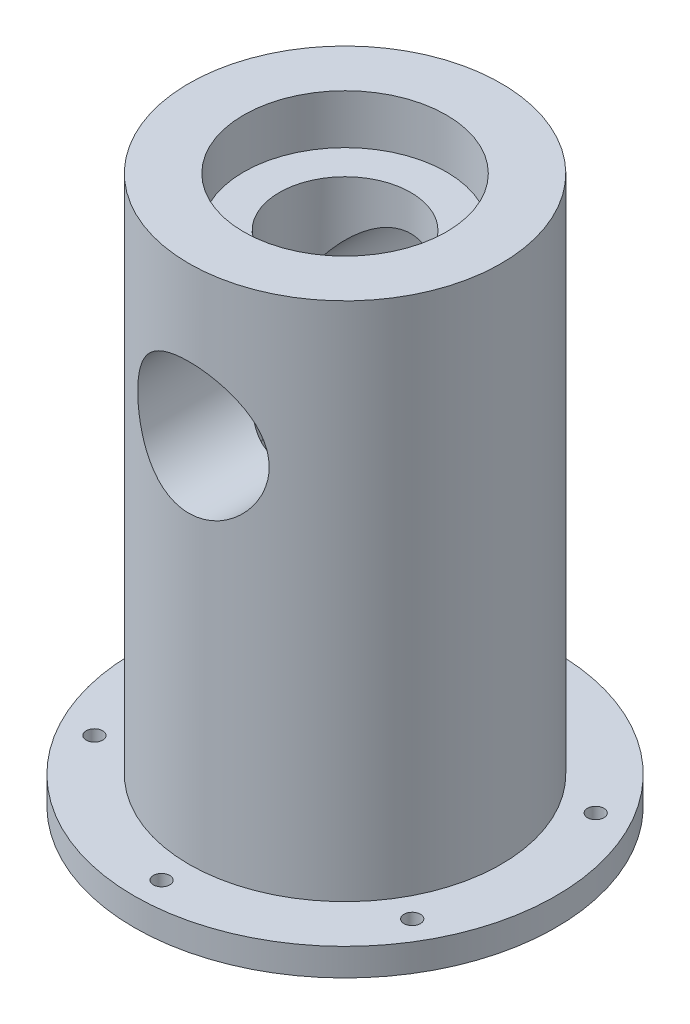
from build123d import *

# Parameters (mm, degrees)
ESQUISSE1_R             = 38.5
BOSS_EXTRU_1_DEPTH      = 100
ENL_V_START             = -95
ESQUISSE2_R             = 38.5
ESQUISSE2_R_2           = 28.5
ENL_V_MAT_EXTRU_1_DEPTH = 95
ESQUISSE4_R             = 22.5
ENL_V_MAT_EXTRU_2_DEPTH = 45
ESQUISSE5_R             = 18.5
ENL_V_MAT_EXTRU_3_DEPTH = 9
ESQUISSE6_R             = 12
ENL_V_MAT_EXTRU_4_DEPTH = 77.684418235
D_GAGEMENT_M222_D       = 24
ESQUISSE14_R            = 1.5
ENL_V_MAT_EXTRU_8_DEPTH = 77.684418235
ENL_V_START_2           = -9
ESQUISSE16_R            = 18.5
ENL_V_MAT_EXTRU_9_DEPTH = 9


with BuildPart() as part:
    # Esquisse1 → Boss.-Extru.1 (new body)
    with BuildSketch(Plane(origin=(0, 0, 0), x_dir=(1, 0, 0), z_dir=(0, 1, 0))):
        with Locations(Location((0, 0, 0), (0, 0, 270))):
            Circle(ESQUISSE1_R)
    extrude(amount=BOSS_EXTRU_1_DEPTH)

    # Esquisse2 → Enlèv. mat.-Extru.1 (cut)
    with BuildSketch(Plane(origin=(0, 100, 0), x_dir=(1, 0, 0), z_dir=(0, 1, 0)).offset(ENL_V_START)):
        with Locations(Location((0, 0, 0), (0, 0, 270))):
            Circle(ESQUISSE2_R)
        with Locations(Location((0, 0, 0), (0, 0, 270))):
            Circle(ESQUISSE2_R_2, mode=Mode.SUBTRACT)
    extrude(amount=ENL_V_MAT_EXTRU_1_DEPTH, mode=Mode.SUBTRACT)

    # Esquisse4 → Enlèv. mat.-Extru.2 (cut)
    with BuildSketch(Plane(origin=(0, 0, 0), x_dir=(-1, 0, 0), z_dir=(0, -1, 0))):
        with Locations(Location((0, 0, 0), (0, 0, 90))):
            Circle(ESQUISSE4_R)
    extrude(amount=-ENL_V_MAT_EXTRU_2_DEPTH, mode=Mode.SUBTRACT)

    # Esquisse5 → Enlèv. mat.-Extru.3 (cut)
    with BuildSketch(Plane(origin=(0, 45, 0), x_dir=(-1, 0, 0), z_dir=(0, -1, 0))):
        with Locations(Location((0, 0, 0), (0, 0, 90))):
            Circle(ESQUISSE5_R)
    extrude(amount=-ENL_V_MAT_EXTRU_3_DEPTH, mode=Mode.SUBTRACT)

    # Esquisse6 → Enlèv. mat.-Extru.4 (cut, through all)
    with BuildSketch(Plane(origin=(0, 54, 0), x_dir=(-1, 0, 0), z_dir=(0, -1, 0))):
        with Locations(Location((0, 0, 0), (0, 0, 90))):
            Circle(ESQUISSE6_R)
    extrude(amount=-ENL_V_MAT_EXTRU_4_DEPTH, mode=Mode.SUBTRACT)

    # Dégagement M222 (through all)
    with Locations(Plane(origin=(0, 72.5, 28.5), x_dir=(1, 0, 0), z_dir=(0, 0, 1))):
        with Locations((0, 0)):
            Hole(D_GAGEMENT_M222_D / 2)

    # Esquisse14 → Enlèv. mat.-Extru.8 (cut, through all)
    with BuildSketch(Plane(origin=(0, 54, 0), x_dir=(-1, 0, 0), z_dir=(0, -1, 0))):
        with Locations(Location((0, -33.5, 0), (0, 0, 270))):
            Circle(ESQUISSE14_R)
        with Locations(Location((-29.011851027, -16.75, 0), (0, 0, 270))):
            Circle(ESQUISSE14_R)
        with Locations(Location((-29.011851027, 16.75, 0), (0, 0, 270))):
            Circle(ESQUISSE14_R)
        with Locations(Location((0, 33.5, 0), (0, 0, 270))):
            Circle(ESQUISSE14_R)
        with Locations(Location((29.011851027, 16.75, 0), (0, 0, 270))):
            Circle(ESQUISSE14_R)
        with Locations(Location((29.011851027, -16.75, 0), (0, 0, 270))):
            Circle(ESQUISSE14_R)
    extrude(amount=ENL_V_MAT_EXTRU_8_DEPTH, mode=Mode.SUBTRACT)

    # Esquisse16 → Enlèv. mat.-Extru.9 (cut)
    with BuildSketch(Plane(origin=(0, 100, 0), x_dir=(1, 0, 0), z_dir=(0, 1, 0)).offset(ENL_V_START_2)):
        with Locations(Location((0, 0, 0), (0, 0, 90))):
            Circle(ESQUISSE16_R)
    extrude(amount=ENL_V_MAT_EXTRU_9_DEPTH, mode=Mode.SUBTRACT)


solid = part.part
